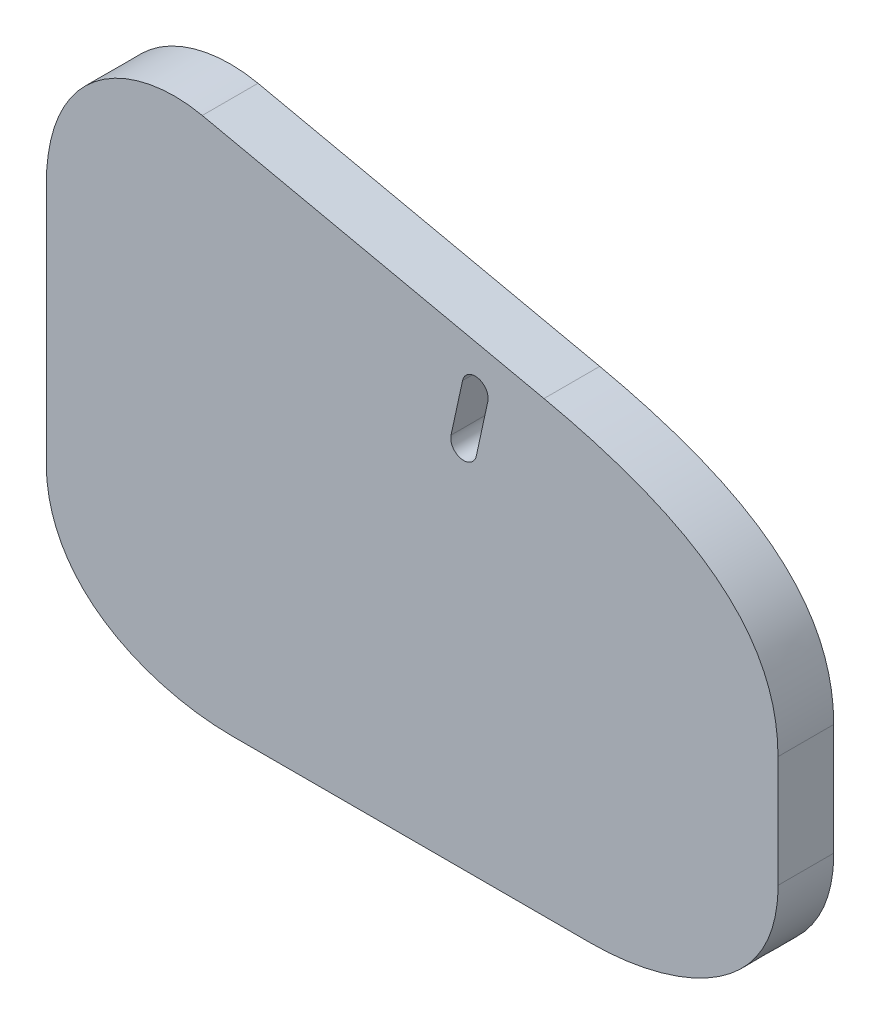
from build123d import *

# Parameters (mm, degrees)
EXTRUDE_1_DEPTH = 10


with BuildPart() as part:
    # Эскиз1_fr → Бобышка-Вытянуть1 (new body)
    with BuildSketch(Plane.XY):
        with BuildLine():
            add(Edge.make_bspline(
                [(-97.969549234, -25.769768053), (-112.011160689, -25.769768053), (-131.292525164, -19.025155818), (-131.292525164, 0)],
                knots=[0, 0, 0, 0, 1, 1, 1, 1], degree=3))
            Line((-131.292525164, 0), (-131.292525164, 43.097715536))
            add(Edge.make_bspline(
                [(-103.301225383, 67.978870897), (-115.500001367, 70.63077872), (-131.292525164, 63.393306184), (-131.292525164, 43.097715536)],
                knots=[0, 0, 0, 0, 1, 1, 1, 1], degree=3))
            Line((-103.301225383, 67.978870897), (-41.986949672, 54.649680525))
            add(Edge.make_bspline(
                [(0, 20), (0, 38.146025899), (-14.209474182, 48.611098897), (-41.986949672, 54.649680525)],
                knots=[0, 0, 0, 0, 1, 1, 1, 1], degree=3))
            Line((0, 20), (0, 0))
            add(Edge.make_bspline(
                [(-33.545129103, -25.769768053), (-19.444866568, -25.769768053), (0, -19.063757455), (0, 0)],
                knots=[0, 0, 0, 0, 1, 1, 1, 1], degree=3))
            Line((-33.545129103, -25.769768053), (-97.969549234, -25.769768053))
        make_face()
        with BuildLine():
            ThreePointArc((-58.66509027, 40.632464429), (-56.891886772, 37.874147876), (-54.133570218, 39.647351375))
            Line((-54.133570218, 39.647351375), (-52.067053016, 49.153330507))
            ThreePointArc((-52.067053016, 49.153330507), (-53.840256514, 51.91164706), (-56.598573068, 50.138443562))
            Line((-56.598573068, 50.138443562), (-58.66509027, 40.632464429))
        make_face(mode=Mode.SUBTRACT)
    extrude(amount=EXTRUDE_1_DEPTH)


solid = part.part
